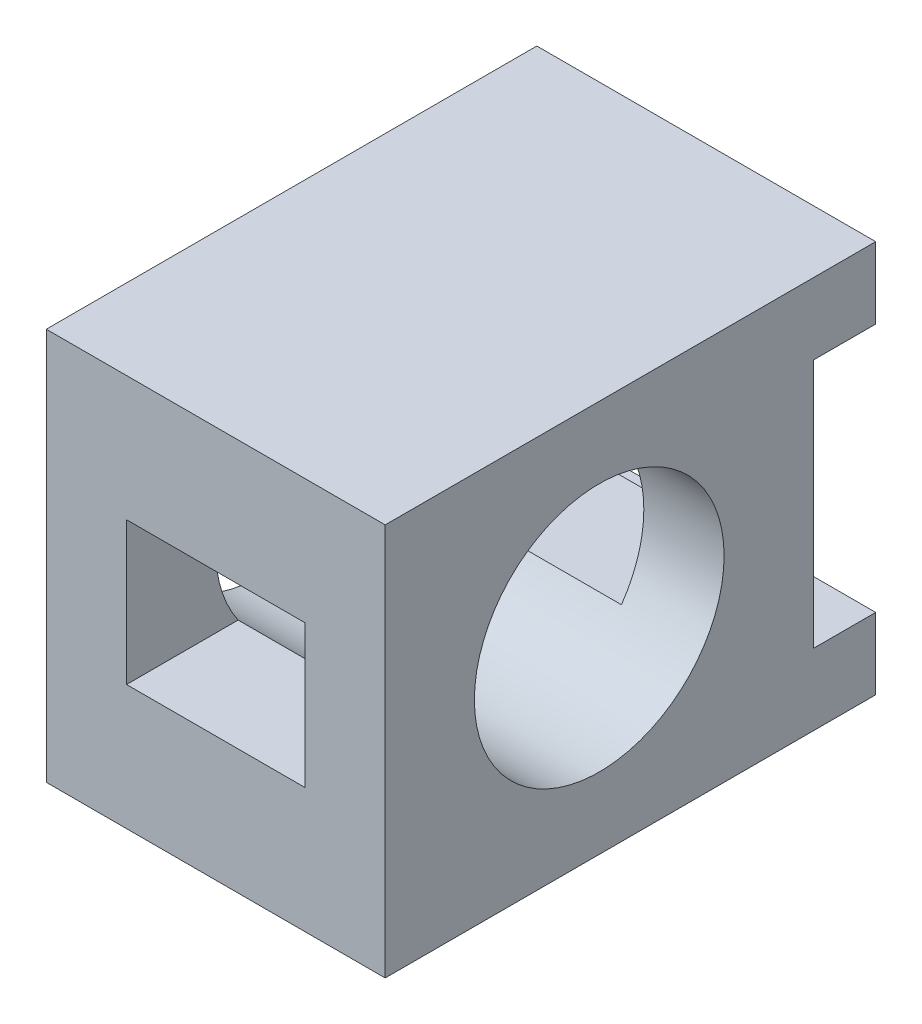
from build123d import *

# Parameters (mm, degrees)
SKETCH1_W           = 38
SKETCH1_H           = 44
BOSS_EXTRUDE1_DEPTH = 27.5
SKETCH2_W           = 20
SKETCH2_H           = 16
CUT_EXTRUDE1_DEPTH  = 55
SKETCH3_R           = 14
CUT_EXTRUDE2_DEPTH  = 55
SKETCH4_W           = 7
SKETCH4_H           = 28
CUT_EXTRUDE3_DEPTH  = 65.313684391


with BuildPart() as part:
    # Sketch1 → Boss-Extrude1 (new, symmetric)
    with BuildSketch(Plane.XY):
        with Locations((19, 22)):
            Rectangle(SKETCH1_W, SKETCH1_H)
    extrude(amount=BOSS_EXTRUDE1_DEPTH, both=True)

    # Sketch2 → Cut-Extrude1 (cut)
    with BuildSketch(Plane.XY.offset(27.5)):
        with Locations((19, 22)):
            Rectangle(SKETCH2_W, SKETCH2_H)
    extrude(amount=-CUT_EXTRUDE1_DEPTH, mode=Mode.SUBTRACT)

    # Sketch3 → Cut-Extrude2 (cut)
    with BuildSketch(Plane(origin=(38, 0, 0), x_dir=(0, 0, -1), z_dir=(1, 0, 0))):
        with Locations((-3.5, 22)):
            Circle(SKETCH3_R)
    extrude(amount=-CUT_EXTRUDE2_DEPTH, mode=Mode.SUBTRACT)

    # Sketch4 → Cut-Extrude3 (cut, through all)
    with BuildSketch(Plane(origin=(38, 0, 0), x_dir=(0, 0, -1), z_dir=(1, 0, 0))):
        with Locations((24, 22)):
            Rectangle(SKETCH4_W, SKETCH4_H)
    extrude(amount=-CUT_EXTRUDE3_DEPTH, mode=Mode.SUBTRACT)


solid = part.part
